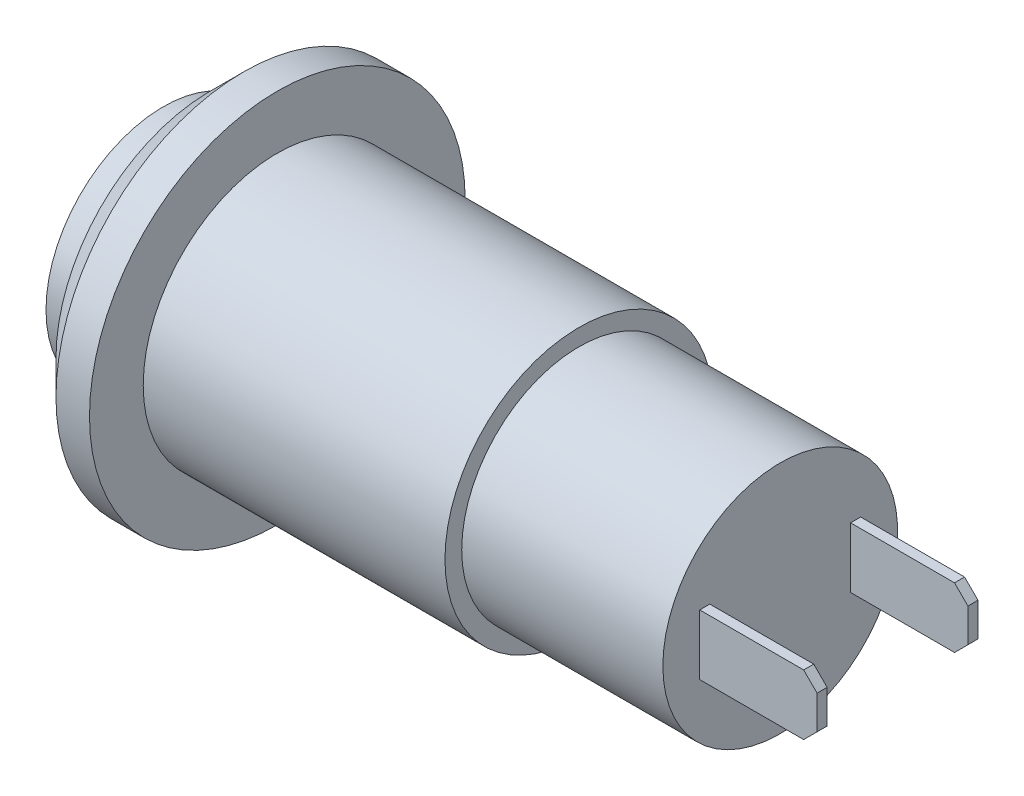
from build123d import *

# Parameters (mm, degrees)
CHAMFER_1_SIZE  = 1
SKETCH_4_W      = 0.3
SKETCH_4_H      = 1.8
EXTRUDE_1_DEPTH = 3.5
CHAMFER_2_SIZE  = 0.4


with BuildPart() as part:
    # 草图2 → 旋转2 (revolve)
    with BuildSketch(Plane.XY, mode=Mode.PRIVATE) as revolve_2_sk:
        Polygon((0, 0), (0, -3.5), (1.4, -3.5), (1.4, -5.60259245), (3.4, -5.60259245), (3.4, -4), (12.4, -4), (12.4, -3.5), (18.4, -3.5), (18.4, 0), align=None)
    revolve(revolve_2_sk.sketch.rotate(Axis((-3.092696523, 0, 0), (1, 0, 0)), 270), axis=Axis((-3.092696523, 0, 0), (1, 0, 0)))

    # 倒角1
    chamfer_1_edges = [part.edges().sort_by_distance(p)[0] for p in [
        (1.4, 0, -5.60259245),
    ]]
    chamfer(chamfer_1_edges, length=CHAMFER_1_SIZE)

    # 草图4 → 凸台-拉伸1 (add)
    with BuildSketch(Plane(origin=(18.4, 0, 0), x_dir=(0, 0, -1), z_dir=(1, 0, 0))):
        with Locations((-2.25, 0)):
            Rectangle(SKETCH_4_W, SKETCH_4_H)
        with Locations((2.25, 0)):
            Rectangle(SKETCH_4_W, SKETCH_4_H)
    extrude(amount=EXTRUDE_1_DEPTH)

    # 倒角2
    chamfer_2_edges = [part.edges().sort_by_distance(p)[0] for p in [
        (21.9, -0.9, 2.25),
        (21.9, 0.9, 2.25),
        (21.9, -0.9, -2.25),
        (21.9, 0.9, -2.25),
    ]]
    chamfer(chamfer_2_edges, length=CHAMFER_2_SIZE)


solid = part.part
